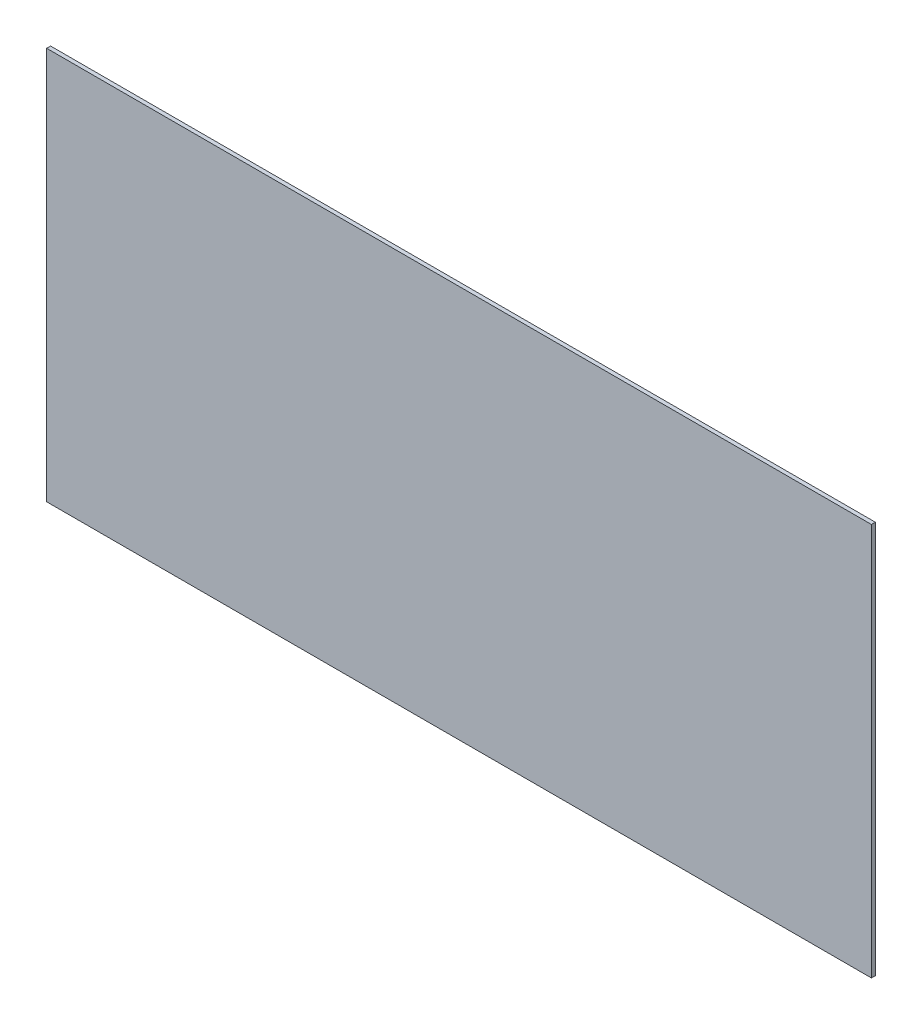
from build123d import *

# Parameters (mm, degrees)
SKETCH_1_W      = 2100
SKETCH_1_H      = 1000
EXTRUDE_1_DEPTH = 10


with BuildPart() as part:
    # Эскиз1 → Бобышка-Вытянуть1 (new body)
    with BuildSketch(Plane.XY):
        with Locations((1050, 500)):
            Rectangle(SKETCH_1_W, SKETCH_1_H)
    extrude(amount=EXTRUDE_1_DEPTH)


solid = part.part
